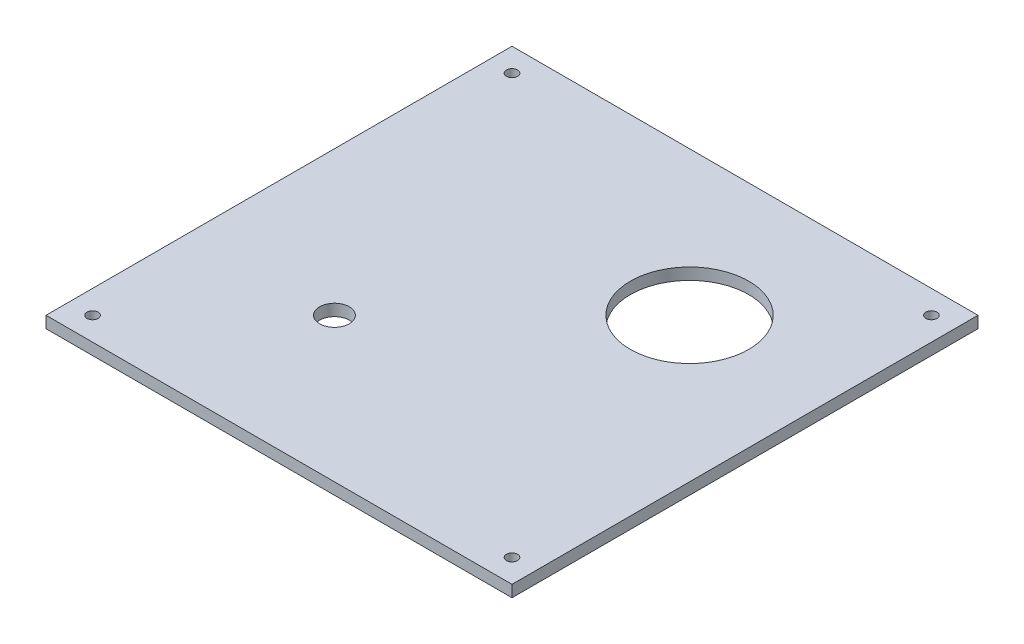
from build123d import *

# Parameters (mm, degrees)
SKETCH1_W           = 200
SKETCH1_H           = 200
BOSS_EXTRUDE1_DEPTH = 2.5
SKETCH2_R           = 2.38125
CUT_EXTRUDE1_DEPTH  = 5
SKETCH3_R           = 6.35
CUT_EXTRUDE2_DEPTH  = 5
SKETCH4_R           = 25.4
CUT_EXTRUDE3_DEPTH  = 142.509716981


with BuildPart() as part:
    # Sketch1 → Boss-Extrude1 (new, symmetric)
    with BuildSketch(Plane(origin=(0, 0, 0), x_dir=(1, 0, 0), z_dir=(0, 1, 0))):
        Rectangle(SKETCH1_W, SKETCH1_H)
    extrude(amount=BOSS_EXTRUDE1_DEPTH, both=True)

    # Sketch2 → Cut-Extrude1 (cut)
    with BuildSketch(Plane(origin=(0, 2.5, 0), x_dir=(1, 0, 0), z_dir=(0, 1, 0))):
        with Locations(Location((-90, 90, 0), (0, 0, 270))):
            Circle(SKETCH2_R)
        with Locations(Location((90, 90, 0), (0, 0, 270))):
            Circle(SKETCH2_R)
        with Locations(Location((-90, -90, 0), (0, 0, 270))):
            Circle(SKETCH2_R)
        with Locations(Location((90, -90, 0), (0, 0, 270))):
            Circle(SKETCH2_R)
    extrude(amount=-CUT_EXTRUDE1_DEPTH, mode=Mode.SUBTRACT)

    # Sketch3 → Cut-Extrude2 (cut)
    with BuildSketch(Plane(origin=(0, 2.5, 0), x_dir=(1, 0, 0), z_dir=(0, 1, 0))):
        with Locations(Location((-38.1, -38.1, 0), (0, 0, 270))):
            Circle(SKETCH3_R)
    extrude(amount=-CUT_EXTRUDE2_DEPTH, mode=Mode.SUBTRACT)

    # Sketch4 → Cut-Extrude3 (cut, through all)
    with BuildSketch(Plane(origin=(0, 2.5, 0), x_dir=(1, 0, 0), z_dir=(0, 1, 0))):
        with Locations(Location((38.1, 38.1, 0), (0, 0, 270))):
            Circle(SKETCH4_R)
    extrude(amount=-CUT_EXTRUDE3_DEPTH, mode=Mode.SUBTRACT)


solid = part.part
